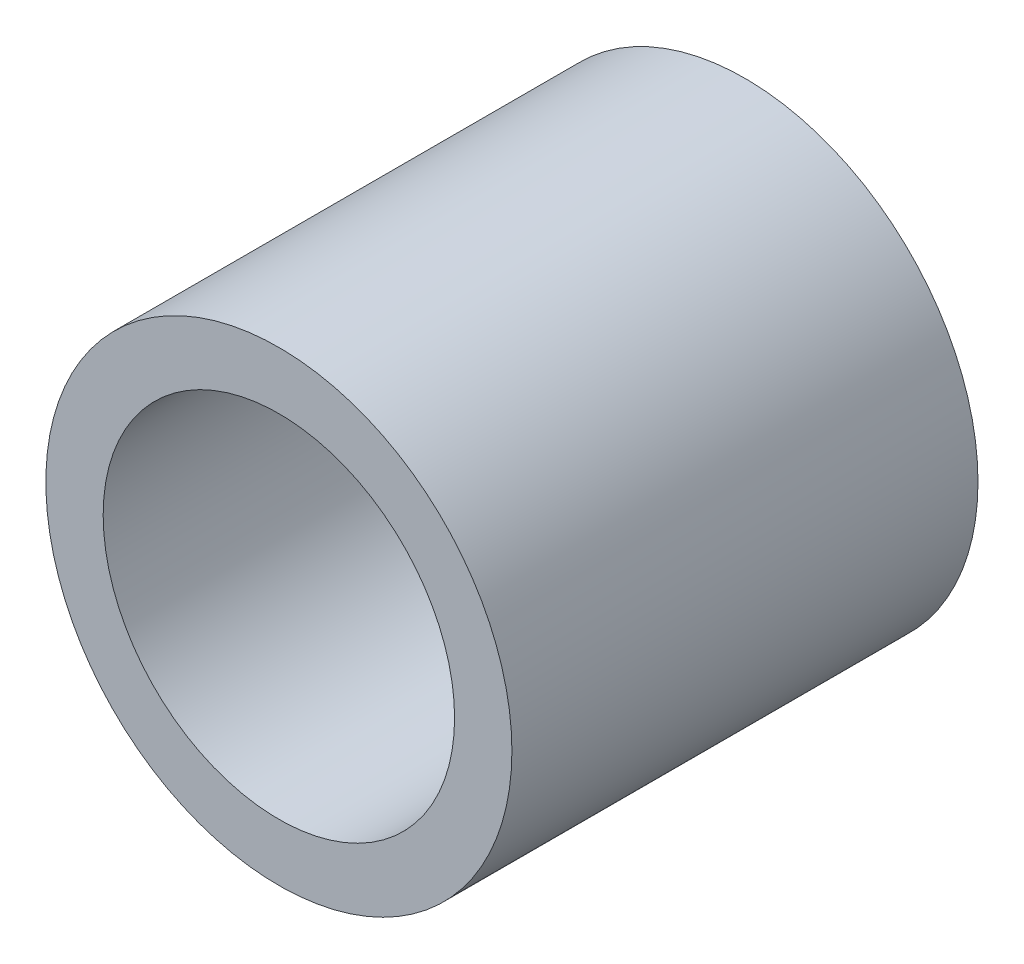
from build123d import *

# Parameters (mm, degrees)
SKETCH1_R      = 6.35
SKETCH1_R_2    = 4.7879
EXTRUDE1_DEPTH = 6.35


with BuildPart() as part:
    # Sketch1 → Extrude1 (new, symmetric)
    with BuildSketch(Plane.XY):
        Circle(SKETCH1_R)
        Circle(SKETCH1_R_2, mode=Mode.SUBTRACT)
    extrude(amount=EXTRUDE1_DEPTH, both=True)


solid = part.part
